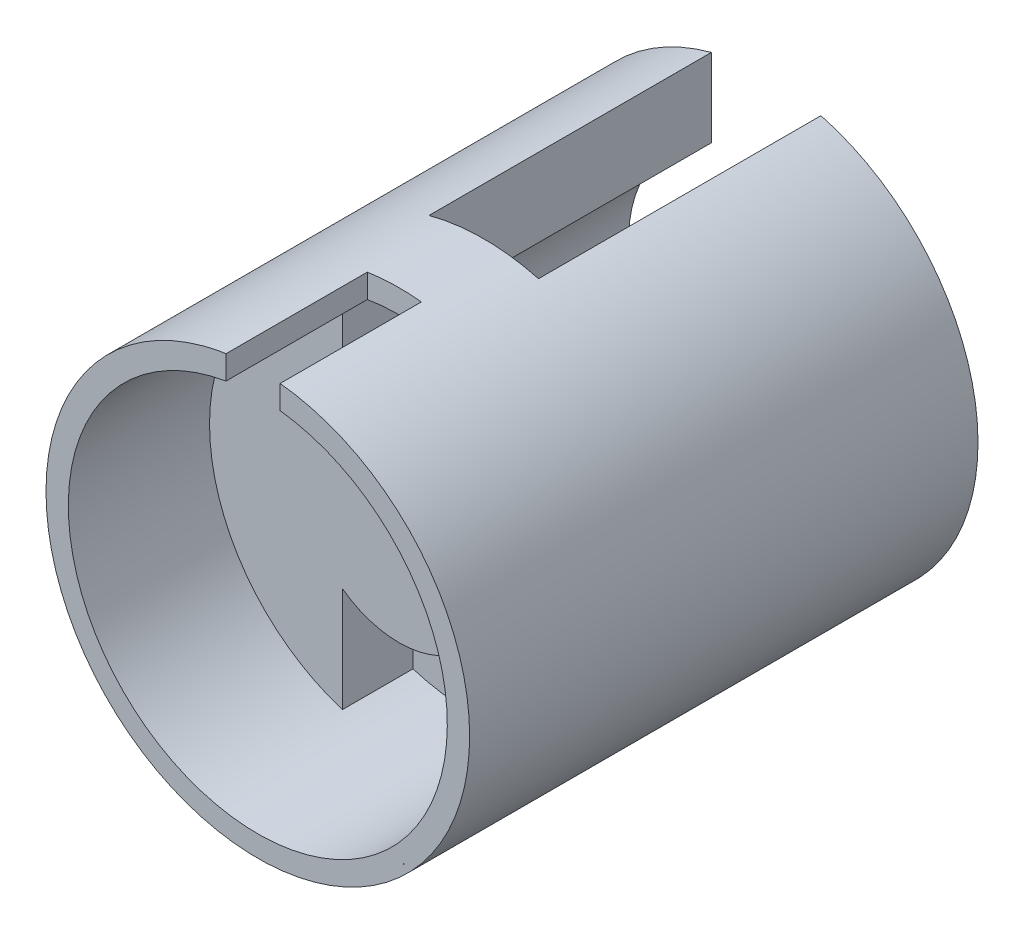
from build123d import *

# Parameters (mm, degrees)
SKETCH1_R            = 15
BOSS_EXTRUDE2_DEPTH  = 5
SKETCH10_R           = 0.026716532
BOSS_EXTRUDE10_DEPTH = 10
BOSS_EXTRUDE13_START = 1
SKETCH12_R           = 15
BOSS_EXTRUDE13_DEPTH = 1
BOSS_EXTRUDE14_START = 20
BOSS_EXTRUDE14_DEPTH = 20


with BuildPart() as part:
    # Sketch1 → Boss-Extrude2 (new body)
    with BuildSketch(Plane.XY):
        with Locations((0.153154005, 2.896729922)):
            Circle(SKETCH1_R)
        with BuildLine():
            Line((-3.858366409, 8.353410796), (-3.858366409, 15.623324251))
            ThreePointArc((-3.858366409, 15.623324251), (0.153154005, 16.236968805), (4.164674419, 15.623324251))
            Line((4.164674419, 15.623324251), (4.164674419, 8.353410796))
            ThreePointArc((4.164674419, 8.353410796), (0.153154005, 9.669296806), (-3.858366409, 8.353410796))
        make_face(mode=Mode.SUBTRACT)
        with BuildLine():
            Line((-3.858366409, -2.559950952), (-3.858366409, -9.987163584))
            ThreePointArc((-3.858366409, -9.987163584), (0.153154005, -10.600808139), (4.164674419, -9.987163584))
            Line((4.164674419, -9.987163584), (4.164674419, -2.559950952))
            ThreePointArc((4.164674419, -2.559950952), (0.153154005, -3.875836962), (-3.858366409, -2.559950952))
        make_face(mode=Mode.SUBTRACT)
    extrude(amount=BOSS_EXTRUDE2_DEPTH)

    # Sketch10 → Boss-Extrude10 (add)
    with BuildSketch(Plane.XY.offset(5)):
        with BuildLine():
            Line((-2.094128576, 16.047452534), (-2.094128576, 17.727431895))
            ThreePointArc((-2.094128576, 17.727431895), (-9.62669163, -8.476687302), (15.153154005, 2.896729922))
            ThreePointArc((15.153154005, 2.896729922), (11.304753393, 12.928770148), (1.734243192, 17.813169074))
            Line((1.734243192, 17.813169074), (1.734243192, 16.14349683))
            ThreePointArc((1.734243192, 16.14349683), (2.961528164, 15.939802873), (4.164674419, 15.623324251))
            ThreePointArc((4.164674419, 15.623324251), (13.572042477, 2.818080333), (4.164674419, -9.987163584))
            ThreePointArc((4.164674419, -9.987163584), (0.153154005, -10.600808139), (-3.858366409, -9.987163584))
            ThreePointArc((-3.858366409, -9.987163584), (-13.265734467, 2.818080333), (-3.858366409, 15.623324251))
            ThreePointArc((-3.858366409, 15.623324251), (-2.983424534, 15.865242588), (-2.094128576, 16.047452534))
        make_face()
        with Locations((10.491847297, -7.276178058)):
            Circle(SKETCH10_R, mode=Mode.SUBTRACT)
    extrude(amount=BOSS_EXTRUDE10_DEPTH)

    # Sketch12 → Boss-Extrude13 (add)
    with BuildSketch(Plane(origin=(0, 0, 0), x_dir=(-1, 0, 0), z_dir=(0, 0, -1)).offset(BOSS_EXTRUDE13_START)):
        with Locations((-0.153154005, 2.896729922)):
            Circle(SKETCH12_R)
    extrude(amount=-BOSS_EXTRUDE13_DEPTH)

    # Sketch13 → Boss-Extrude14 (add)
    with BuildSketch(Plane(origin=(0, 0, -1), x_dir=(-1, 0, 0), z_dir=(0, 0, -1)).offset(BOSS_EXTRUDE14_START)):
        with BuildLine():
            ThreePointArc((9.596845995, 2.896729922), (-5.50307382, -5.254396256), (-4.032047949, 11.841934323))
            Line((-4.032047949, 11.841934323), (-4.032047949, 17.386525703))
            ThreePointArc((-4.032047949, 17.386525703), (-9.285968216, -9.002501338), (14.846845995, 2.896729922))
            ThreePointArc((14.846845995, 2.896729922), (11.746077255, 12.029544133), (3.725739939, 17.386525703))
            Line((3.725739939, 17.386525703), (3.725739939, 11.841934323))
            ThreePointArc((3.725739939, 11.841934323), (7.997972173, 8.246649737), (9.596845995, 2.896729922))
        make_face()
    extrude(amount=-BOSS_EXTRUDE14_DEPTH)


solid = part.part
